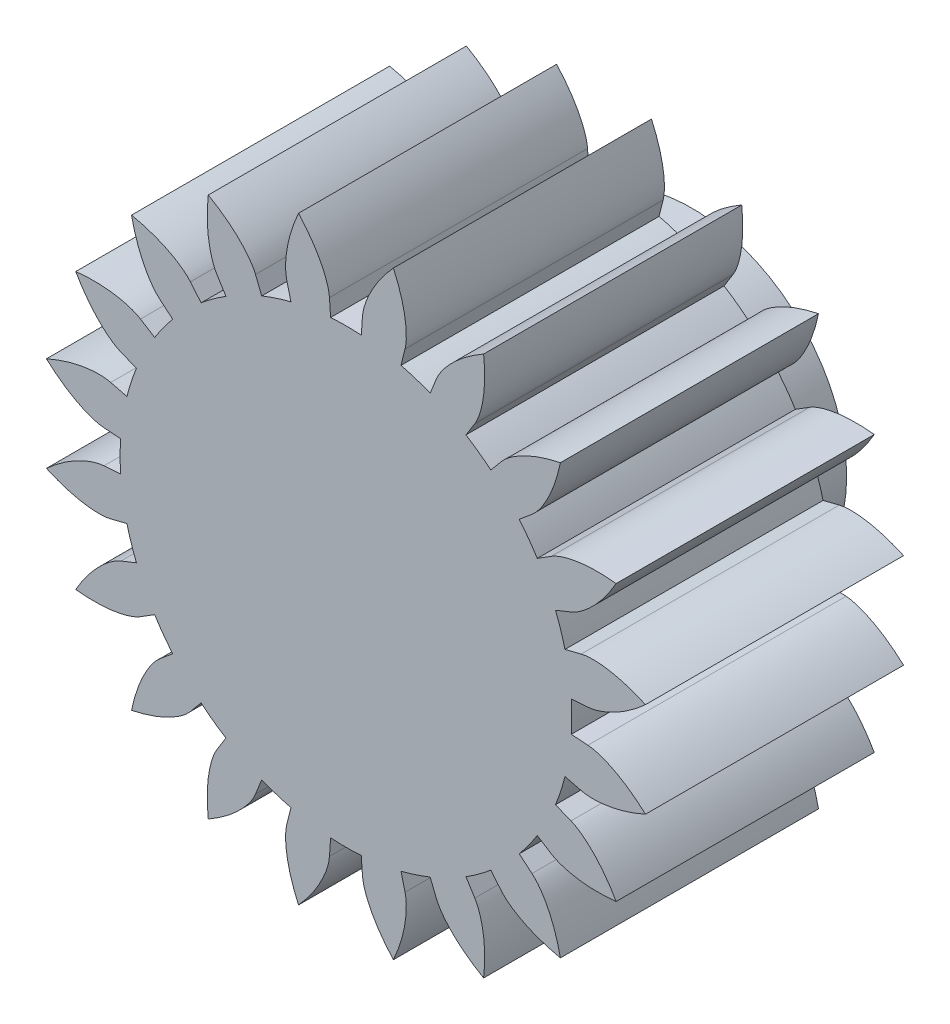
from build123d import *

# Parameters (mm, degrees)
SKETCH_1_R               = 5.5
SKETCH_1_R_2             = 1.475
EXTRUDE_1_DEPTH          = 5
SKETCH_6_R               = 6
SKETCH_6_R_2             = 5.5
EXTRUDE_4_DEPTH          = 5
CUT_EXTRUDE_1_DEPTH      = 10.848857802
PATTERN_CIRCULAR_1_COUNT = 20
PATTERN_CIRCULAR_1_ANGLE = 342
SKETCH_2_R               = 1.475
EXTRUDE_2_DEPTH          = 5
SKETCH_3_R               = 3
SKETCH_3_R_2             = 2
SKETCH_3_W               = 2
SKETCH_3_H               = 0.5
SKETCH_3_W_2             = 0.5
SKETCH_3_H_2             = 2
EXTRUDE_3_DEPTH          = 1.7
CUT_EXTRUDE_START        = -1
SKETCH_5_R               = 2
CUT_EXTRUDE_2_DEPTH      = 1


with BuildPart() as part:
    # 草图1 → 凸台-拉伸1 (new body)
    with BuildSketch(Plane.XY):
        Circle(SKETCH_1_R)
        Circle(SKETCH_1_R_2, mode=Mode.SUBTRACT)
    extrude(amount=EXTRUDE_1_DEPTH)

    # 草图6 → 凸台-拉伸4 (add)
    with BuildSketch(Plane(origin=(0, 0, 0), x_dir=(-1, 0, 0), z_dir=(0, 0, -1))):
        Circle(SKETCH_6_R)
        Circle(SKETCH_6_R_2, mode=Mode.SUBTRACT)
    extrude(amount=-EXTRUDE_4_DEPTH)

    # 草图1<3> → 切除-拉伸1 (cut, through all)
    with BuildSketch(Plane.XY):
        with BuildLine():
            Line((4.68759624, 0.319369739), (4.364881259, 0.297382905))
            ThreePointArc((4.364881259, 0.297382905), (4.372469583, 0.148777503), (4.375, 0))
            ThreePointArc((4.375, 0), (4.372469583, -0.148777503), (4.364881259, -0.297382905))
            Line((4.364881259, -0.297382905), (4.68759624, -0.319369739))
            add(Edge.make_bspline(
                [(4.68759624, -0.319369739), (4.723328518, -0.321804208), (4.822539562, -0.336024472), (5.006239619, -0.392562489), (5.199142564, -0.482491423), (5.35109765, -0.572850293), (5.444197274, -0.635344688), (5.461765036, -0.647396861)],
                knots=[0, 0, 0, 0, 0, 0.005604068, 0.015718248, 0.029959916, 0.033300536, 0.033300536, 0.033300536, 0.033300536, 0.033300536], degree=4))
            ThreePointArc((5.461765036, -0.647396861), (5.490432938, -0.324262474), (5.5, 0))
            ThreePointArc((5.5, 0), (5.490432938, 0.324262474), (5.461765036, 0.647396861))
            add(Edge.make_bspline(
                [(4.68759624, 0.319369739), (4.723328518, 0.321804208), (4.822539562, 0.336024472), (5.006239619, 0.392562489), (5.199142564, 0.482491423), (5.35109765, 0.572850293), (5.444197274, 0.635344688), (5.461765036, 0.647396861)],
                knots=[0, 0, 0, 0, 0, 0.005604068, 0.015718248, 0.029959916, 0.033300536, 0.033300536, 0.033300536, 0.033300536, 0.033300536], degree=4))
        make_face()
        with BuildLine():
            add(Edge.make_bspline(
                [(5.461765036, 0.647396861), (5.542925307, 0.703075987), (5.660164645, 0.791829772), (5.771732758, 0.887518803), (5.877750133, 0.989088046), (5.912113353, 1.023188987)],
                knots=[0.033300536, 0.033300536, 0.033300536, 0.033300536, 0.033300536, 0.048733667, 0.056327564, 0.056327564, 0.056327564, 0.056327564, 0.056327564], degree=4))
            ThreePointArc((5.461765036, 0.647396861), (5.490432938, 0.324262474), (5.5, 0))
            ThreePointArc((5.5, 0), (5.490432938, -0.324262474), (5.461765036, -0.647396861))
            add(Edge.make_bspline(
                [(5.461765036, -0.647396861), (5.542925307, -0.703075987), (5.660164645, -0.791829772), (5.771732758, -0.887518803), (5.877750133, -0.989088046), (5.912113353, -1.023188987)],
                knots=[0.033300536, 0.033300536, 0.033300536, 0.033300536, 0.033300536, 0.048733667, 0.056327564, 0.056327564, 0.056327564, 0.056327564, 0.056327564], degree=4))
            ThreePointArc((5.912113353, -1.023188987), (5.977987961, -0.513478277), (6, 0))
            ThreePointArc((6, 0), (5.977987961, 0.513478277), (5.912113353, 1.023188987))
        make_face()
    cut_extrude_1 = extrude(amount=CUT_EXTRUDE_1_DEPTH, mode=Mode.SUBTRACT)

    # 阵列(圆周)1: 切除-拉伸1 ×20 about axis
    pattern_circular_1_axis = Axis((0, 0, 5), (0, 0, -1))
    for i in range(1, PATTERN_CIRCULAR_1_COUNT):
        add(cut_extrude_1.rotate(pattern_circular_1_axis, i * PATTERN_CIRCULAR_1_ANGLE / (PATTERN_CIRCULAR_1_COUNT - 1)), mode=Mode.SUBTRACT)

    # 草图2 → 凸台-拉伸2 (add, through all)
    with BuildSketch(Plane.XY.offset(5)):
        Circle(SKETCH_2_R)
    extrude(amount=-EXTRUDE_2_DEPTH)

    # 草图3 → 凸台-拉伸3 (add)
    # profile 1 of 3: a face of its own
    with BuildSketch(Plane(origin=(0, 0, 0), x_dir=(-1, 0, 0), z_dir=(0, 0, -1))):
        with Locations(Location((0, 0, 0), (0, 0, 180))):
            Circle(SKETCH_3_R)
        Circle(SKETCH_3_R_2, mode=Mode.SUBTRACT)
    # profile 2 of 3: a face of its own
    with BuildSketch(Plane(origin=(0, 0, 0), x_dir=(-1, 0, 0), z_dir=(0, 0, -1))):
        Rectangle(SKETCH_3_W, SKETCH_3_H)
    # profile 3 of 3: a face of its own
    with BuildSketch(Plane(origin=(0, 0, 0), x_dir=(-1, 0, 0), z_dir=(0, 0, -1))):
        Rectangle(SKETCH_3_W_2, SKETCH_3_H_2)
    extrude(amount=EXTRUDE_3_DEPTH)

    # 草图5 → 切除-拉伸2 (cut)
    with BuildSketch(Plane(origin=(0, 0, -1.7), x_dir=(-1, 0, 0), z_dir=(0, 0, -1)).offset(CUT_EXTRUDE_START)):
        Circle(SKETCH_5_R)
    extrude(amount=CUT_EXTRUDE_2_DEPTH, mode=Mode.SUBTRACT)


solid = part.part
